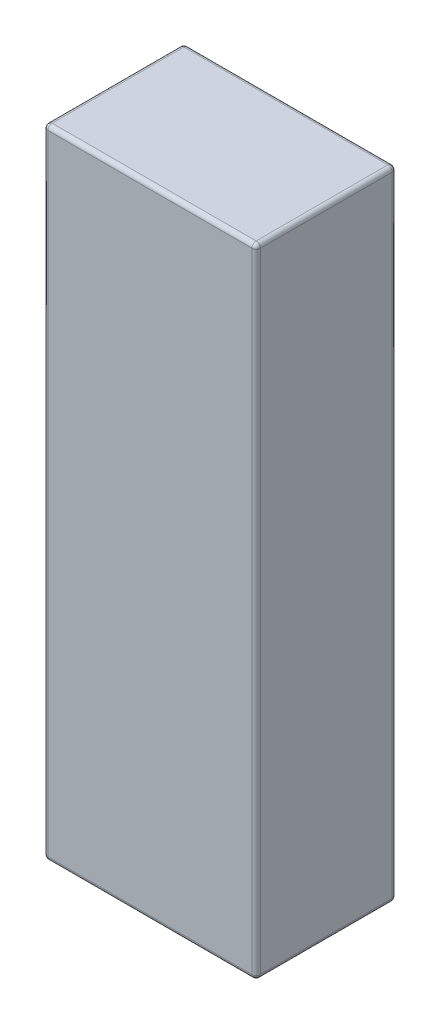
from build123d import *

# Parameters (mm, degrees)
SKETCH1_W           = 50
SKETCH1_H           = 33
BOSS_EXTRUDE1_DEPTH = 75
FILLET1_R           = 1


with BuildPart() as part:
    # Sketch1 → Boss-Extrude1 (new, symmetric)
    with BuildSketch(Plane(origin=(0, 0, 0), x_dir=(1, 0, 0), z_dir=(0, 1, 0))):
        Rectangle(SKETCH1_W, SKETCH1_H)
    extrude(amount=BOSS_EXTRUDE1_DEPTH, both=True)

    # Fillet1
    fillet1_edges = [part.edges().sort_by_distance(p)[0] for p in [
        (-25, 75, 0),
        (0, 75, 16.5),
        (25, 75, 0),
        (0, -75, 16.5),
        (-25, -75, 0),
        (0, -75, -16.5),
        (25, -75, 0),
        (0, 75, -16.5),
        (25, 0, 16.5),
        (-25, 0, 16.5),
        (-25, 0, -16.5),
        (25, 0, -16.5),
    ]]
    fillet(fillet1_edges, radius=FILLET1_R)


solid = part.part
